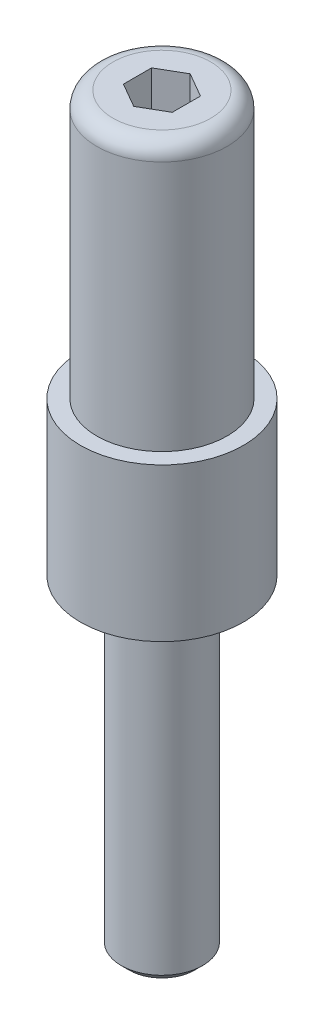
from build123d import *

# Parameters (mm, degrees)
CUT_EXTRUDE_1_DEPTH      = 3
CUT_EXTRUDE_1_DEPTH_BACK = 3


with BuildPart() as part:
    # 草图1 → 旋转1 (revolve)
    with BuildSketch(Plane.XY):
        with BuildLine():
            Line((0, 25.8), (3, 25.8))
            ThreePointArc((3, 25.8), (3.707106781, 25.507106781), (4, 24.8))
            Line((4, 24.8), (4, 9.4))
            Line((4, 9.4), (5, 9.4))
            Line((5, 9.4), (5, 0))
            Line((5, 0), (2.5, 0))
            Line((2.5, 0), (2.5, -19.5095))
            Line((2.5, -19.5095), (2.0095, -20))
            Line((2.0095, -20), (0, -20))
            Line((0, -20), (0, 25.8))
        make_face()
    revolve(axis=Axis((0, -20, 0), (0, 1, 0)))

    # 草图2 → 切除-拉伸1 (cut, two sides: drawn at the far end of the back side and taken through both)
    with BuildSketch(Plane(origin=(0, 25.8, 0), x_dir=(1, 0, 0), z_dir=(0, 1, 0)).offset(-CUT_EXTRUDE_1_DEPTH_BACK)):
        Polygon((-1.5, 0.866025404), (-1.5, -0.866025404), (0, -1.732050808), (1.5, -0.866025404), (1.5, 0.866025404), (0, 1.732050808), align=None)
    extrude(amount=CUT_EXTRUDE_1_DEPTH + CUT_EXTRUDE_1_DEPTH_BACK, mode=Mode.SUBTRACT)


solid = part.part
